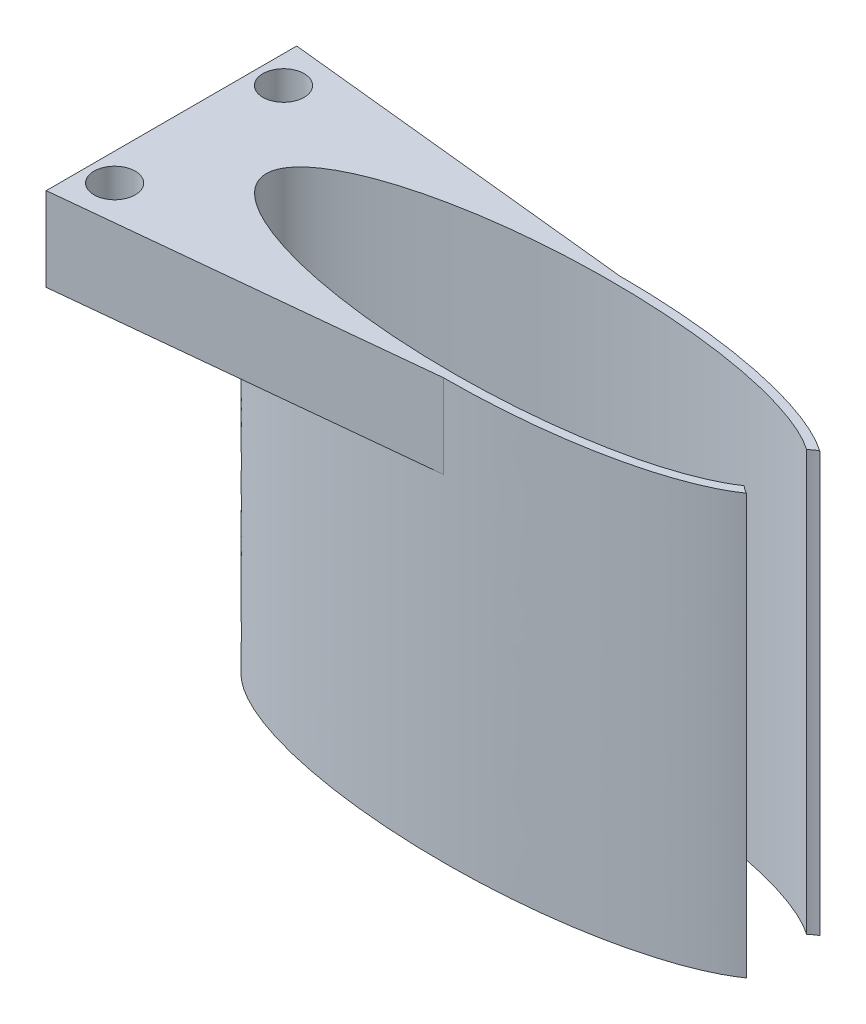
from build123d import *

# Parameters (mm, degrees)
SKETCH1_RX          = 83.867123974
SKETCH1_RY          = 26.715201139
SKETCH1_RX_2        = 80.411426315
SKETCH1_RY_2        = 24.05697217
BOSS_EXTRUDE1_DEPTH = 127.254
SKETCH2_R           = 12.695879526
CUT_EXTRUDE1_DEPTH  = 157.48
BOSS_EXTRUDE2_DEPTH = 25.4
SKETCH5_R           = 6.243439839
CUT_EXTRUDE2_DEPTH  = 148.336


with BuildPart() as part:
    # Sketch1 → Boss-Extrude1 (new body)
    with BuildSketch(Plane(origin=(0, 0, 0), x_dir=(1, 0, 0), z_dir=(0, 1, 0))):
        with Locations((0, 0)):
            Ellipse(SKETCH1_RX, SKETCH1_RY)
        with Locations((0, 0)):
            Ellipse(SKETCH1_RX_2, SKETCH1_RY_2, mode=Mode.SUBTRACT)
    extrude(amount=BOSS_EXTRUDE1_DEPTH)

    # Sketch2 → Cut-Extrude1 (cut)
    with BuildSketch(Plane(origin=(0, 127.254, 0), x_dir=(1, 0, 0), z_dir=(0, 1, 0))):
        with Locations((82.362769104, 0)):
            Circle(SKETCH2_R)
    extrude(amount=-CUT_EXTRUDE1_DEPTH, mode=Mode.SUBTRACT)

    # Sketch4 → Boss-Extrude2 (add)
    with BuildSketch(Plane(origin=(0, 127.254, 0), x_dir=(1, 0, 0), z_dir=(0, 1, 0))):
        with BuildLine():
            Line((-109.288782468, 26.715201139), (-109.288782468, -26.715201139))
            Line((-109.288782468, -26.715201139), (-109.288782468, -37.805360258))
            Line((-109.288782468, -37.805360258), (0, -26.715201139))
            add(Edge.make_bspline(
                [(0, 26.715201139), (-83.867123974, 26.715201139), (-83.867123974, 0), (-83.867123974, -26.715201139), (0, -26.715201139)],
                knots=[1.570796327, 1.570796327, 1.570796327, 3.141592654, 3.141592654, 4.71238898, 4.71238898, 4.71238898], degree=2, weights=[1, 0.707106781, 1, 0.707106781, 1]))
            Line((0, 26.715201139), (-109.288782468, 38.120339295))
            Line((-109.288782468, 38.120339295), (-109.288782468, 26.715201139))
        make_face()
    extrude(amount=-BOSS_EXTRUDE2_DEPTH)

    # Sketch5 → Cut-Extrude2 (cut)
    with BuildSketch(Plane(origin=(0, 127.254, 0), x_dir=(1, 0, 0), z_dir=(0, 1, 0))):
        with Locations(Location((-100.92336604, 25.752966871, 0), (0, 0, 270))):
            Circle(SKETCH5_R)
        with Locations(Location((-100.92336604, -25.437987834, 0), (0, 0, 270))):
            Circle(SKETCH5_R)
    extrude(amount=-CUT_EXTRUDE2_DEPTH, mode=Mode.SUBTRACT)


solid = part.part
